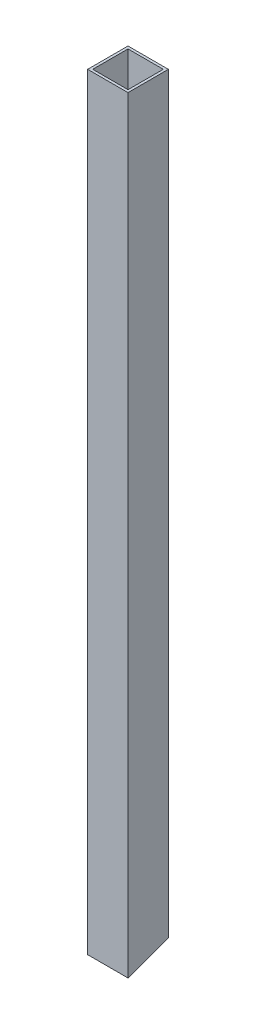
from build123d import *

# Parameters (mm, degrees)
SKETCH1_W           = 25.4
SKETCH1_H           = 25.4
SKETCH1_W_2         = 22.225
SKETCH1_H_2         = 22.225
BOSS_EXTRUDE1_DEPTH = 482.6
CUT_EXTRUDE1_DEPTH  = 482.6


with BuildPart() as part:
    # Sketch1 → Boss-Extrude1 (new body)
    with BuildSketch(Plane(origin=(0, 0, 0), x_dir=(1, 0, 0), z_dir=(0, 1, 0))):
        Rectangle(SKETCH1_W, SKETCH1_H)
        Rectangle(SKETCH1_W_2, SKETCH1_H_2, mode=Mode.SUBTRACT)
    extrude(amount=BOSS_EXTRUDE1_DEPTH)

    # Sketch2 → Cut-Extrude1 (cut)
    with BuildSketch(Plane(origin=(12.7, 0, 0), x_dir=(0, 0, -1), z_dir=(1, 0, 0))):
        Polygon((-12.7, 0), (12.7, 9.24484395), (12.7, 0), align=None)
    extrude(amount=-CUT_EXTRUDE1_DEPTH, mode=Mode.SUBTRACT)


solid = part.part
